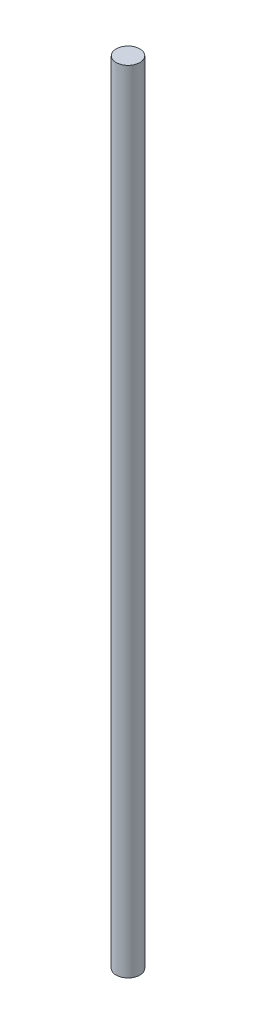
from build123d import *

# Parameters (mm, degrees)
SKETCH2_R           = 6
BOSS_EXTRUDE1_DEPTH = 400


with BuildPart() as part:
    # Sketch2 → Boss-Extrude1 (new body)
    with BuildSketch(Plane(origin=(0, 0, 0), x_dir=(1, 0, 0), z_dir=(0, 1, 0))):
        with Locations(Location((0, 0, 0), (0, 0, 270))):
            Circle(SKETCH2_R)
    extrude(amount=BOSS_EXTRUDE1_DEPTH)


solid = part.part
